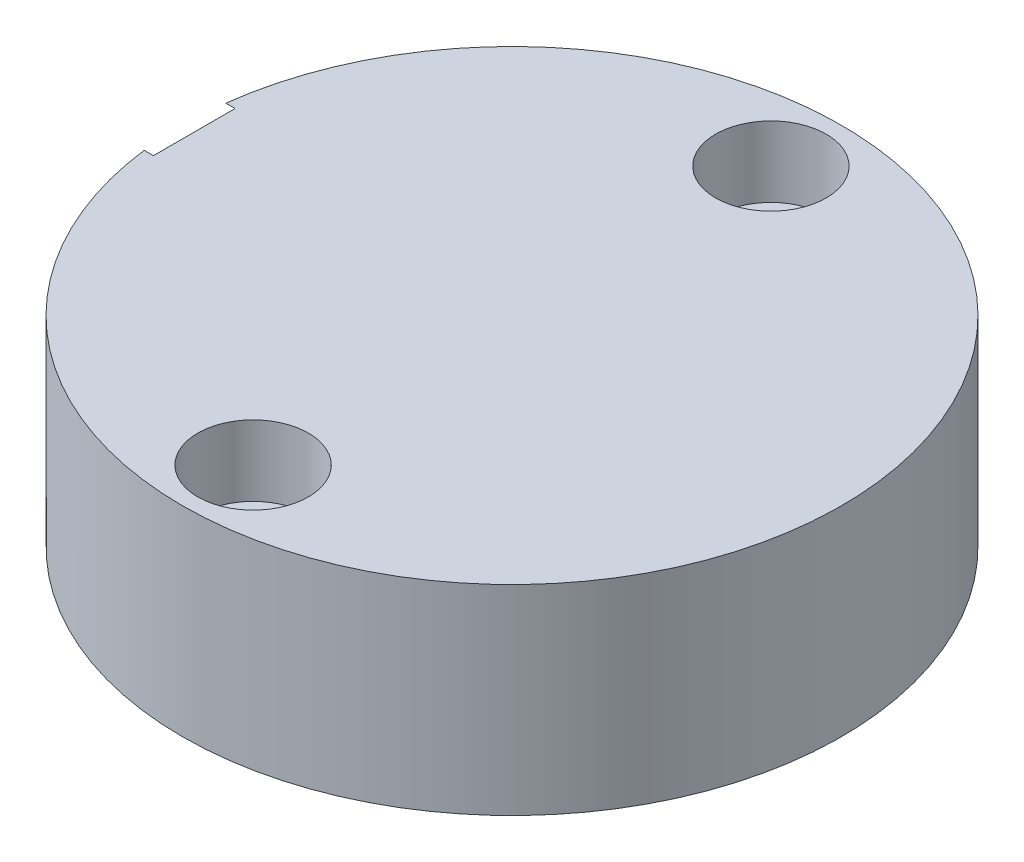
from build123d import *

# Parameters (mm, degrees)
SKETCH1_W                                          = 14.224
SKETCH1_H                                          = 8.636
CBORE_FOR_M2_5_HEX_HEAD_MACHINE_SCREW1_D           = 3.048
CBORE_FOR_M2_5_HEX_HEAD_MACHINE_SCREW1_CBORE_D     = 4.7752
CBORE_FOR_M2_5_HEX_HEAD_MACHINE_SCREW1_CBORE_DEPTH = 3.048
M2_5_CLEARANCE_HOLE1_D                             = 3.048
M2_5_CLEARANCE_HOLE1_DEPTH                         = 2.54
M13_CLEARANCE_HOLE1_D                              = 15.494
M13_CLEARANCE_HOLE1_DEPTH                          = 2.54
CBORE_FOR_M3_5_HEX_HEAD_MACHINE_SCREW1_D           = 3.96748
CBORE_FOR_M3_5_HEX_HEAD_MACHINE_SCREW1_DEPTH       = 7.112
CBORE_FOR_M3_5_HEX_HEAD_MACHINE_SCREW1_CBORE_D     = 7.9375
CBORE_FOR_M3_5_HEX_HEAD_MACHINE_SCREW1_CBORE_DEPTH = 0.508
CBORE_FOR_M3_5_HEX_HEAD_MACHINE_SCREW1_TIP         = 1.145312823
CHAMFER1_SIZE                                      = 0.42926


with BuildPart() as part:
    # Sketch1 → Revolve1 (revolve)
    with BuildSketch(Plane(origin=(0, 0, 0), x_dir=(-1, 0, 0), z_dir=(0, 0, -1)), mode=Mode.PRIVATE) as revolve1_sk:
        with Locations((-7.112, 4.318)):
            Rectangle(SKETCH1_W, SKETCH1_H)
    revolve(revolve1_sk.sketch.rotate(Axis((0, 0, 0), (0, 1, 0)), 270), axis=Axis((0, 0, 0), (0, 1, 0)))

    # CBORE for M2.5 Hex Head Machine Screw1 (through all)
    with Locations(Plane(origin=(0, 8.636, 0), x_dir=(1, 0, 0), z_dir=(0, 1, 0))):
        with Locations((0, -11.176), (0, 11.176)):
            CounterBoreHole(CBORE_FOR_M2_5_HEX_HEAD_MACHINE_SCREW1_D / 2, CBORE_FOR_M2_5_HEX_HEAD_MACHINE_SCREW1_CBORE_D / 2, CBORE_FOR_M2_5_HEX_HEAD_MACHINE_SCREW1_CBORE_DEPTH)

    # M2.5 Clearance Hole1
    with Locations(Plane(origin=(0, 0, 0), x_dir=(-1, 0, 0), z_dir=(0, -1, 0))):
        with Locations((-7.902625387, 7.902625387), (7.902625387, -7.902625387), (-7.902625387, -7.902625387), (7.902625387, 7.902625387)):
            Hole(M2_5_CLEARANCE_HOLE1_D / 2, depth=M2_5_CLEARANCE_HOLE1_DEPTH)

    # M13 Clearance Hole1
    with Locations(Plane(origin=(0, 0, 0), x_dir=(-1, 0, 0), z_dir=(0, -1, 0))):
        with Locations((0, 0)):
            Hole(M13_CLEARANCE_HOLE1_D / 2, depth=M13_CLEARANCE_HOLE1_DEPTH)

    # CBORE for M3.5 Hex Head Machine Screw1
    with Locations(Plane(origin=(-14.224, 5.08, 0), x_dir=(0, 0, -1), z_dir=(-1, 0, 0))):
        with Locations((0, 0)):
            CounterBoreHole(CBORE_FOR_M3_5_HEX_HEAD_MACHINE_SCREW1_D / 2, CBORE_FOR_M3_5_HEX_HEAD_MACHINE_SCREW1_CBORE_D / 2, CBORE_FOR_M3_5_HEX_HEAD_MACHINE_SCREW1_CBORE_DEPTH, depth=CBORE_FOR_M3_5_HEX_HEAD_MACHINE_SCREW1_DEPTH)
            with Locations((0, 0, -(CBORE_FOR_M3_5_HEX_HEAD_MACHINE_SCREW1_DEPTH + CBORE_FOR_M3_5_HEX_HEAD_MACHINE_SCREW1_TIP / 2))):  # 120° drill point
                Cone(0, CBORE_FOR_M3_5_HEX_HEAD_MACHINE_SCREW1_D / 2, CBORE_FOR_M3_5_HEX_HEAD_MACHINE_SCREW1_TIP, mode=Mode.SUBTRACT)

    # Chamfer1
    chamfer1_edges = [part.edges().sort_by_distance(p)[0] for p in [
        (-13.716, 5.08, -1.98374),
    ]]
    chamfer(chamfer1_edges, length=CHAMFER1_SIZE)


solid = part.part
